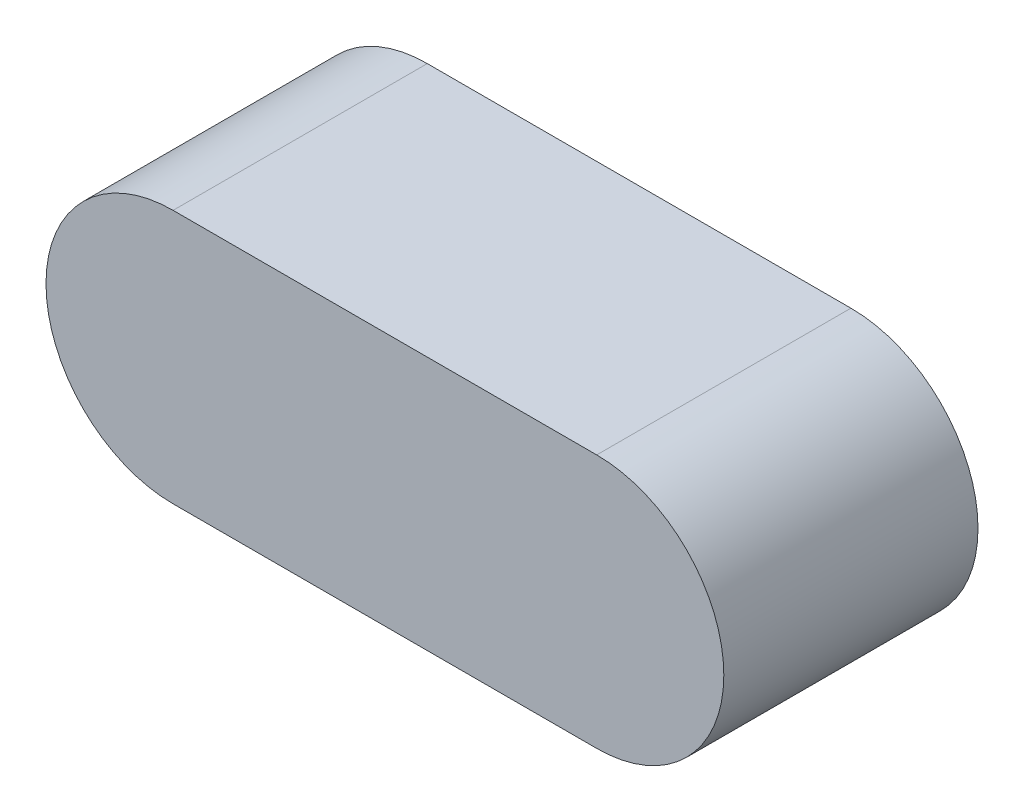
from build123d import *

# Parameters (mm, degrees)
SKETCH1_W         = 12.7
SKETCH1_H         = 4.7625
EXTRUDE1_DEPTH    = 4.7625
SKETCH2_OUTSIDE_W = 17.576
SKETCH2_OUTSIDE_H = 9.638
EXTRUDE2_DEPTH    = 53.218857346


with BuildPart() as part:
    # Sketch1 → Extrude1 (new body)
    with BuildSketch(Plane(origin=(0, 0, 0), x_dir=(1, 0, 0), z_dir=(0, 1, 0))):
        Rectangle(SKETCH1_W, SKETCH1_H)
    extrude(amount=-EXTRUDE1_DEPTH)

    # Sketch2 outside → Extrude2 (cut, through all)
    with BuildSketch(Plane(origin=(44.45, 6.35, 2.38125), x_dir=(-1, 0, 0), z_dir=(0, 0, -1))):
        with Locations((44.45, -8.731)):
            Rectangle(SKETCH2_OUTSIDE_W, SKETCH2_OUTSIDE_H)
        with BuildLine():
            Line((40.48125, -6.35), (48.41875, -6.35))
            ThreePointArc((48.41875, -6.35), (50.8, -8.73125), (48.41875, -11.1125))
            Line((48.41875, -11.1125), (40.48125, -11.1125))
            ThreePointArc((40.48125, -11.1125), (38.1, -8.73125), (40.48125, -6.35))
        make_face(mode=Mode.SUBTRACT)
    extrude(amount=EXTRUDE2_DEPTH, mode=Mode.SUBTRACT)


solid = part.part
